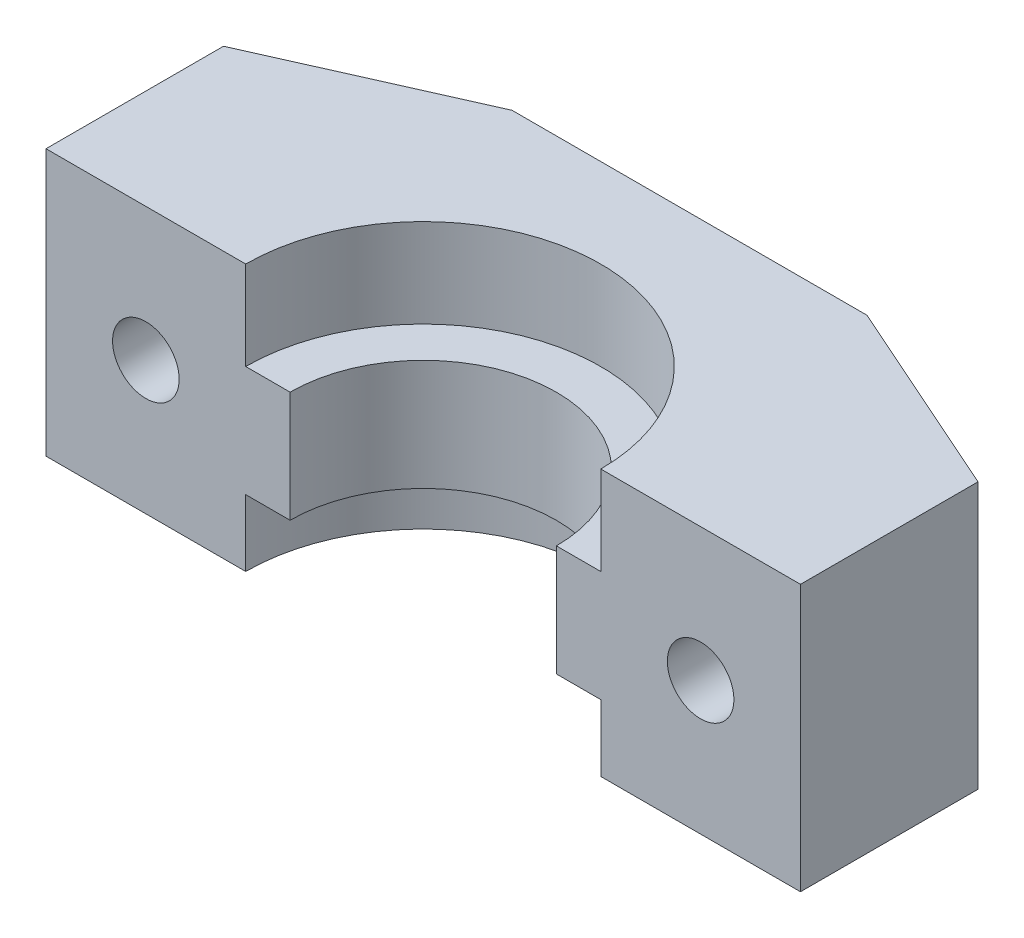
from build123d import *

# Parameters (mm, degrees)
EXTRUDE_1_DEPTH          = 12
SKETCH_3_R               = 1.5
CUT_EXTRUDE_1_DEPTH      = 39
CUT_EXTRUDE_START        = -6
SKETCH_4_R               = 3.5
CUT_EXTRUDE_2_DEPTH      = 33
SKETCH_5_R               = 3.5
CUT_EXTRUDE_4_DEPTH      = 33
CUT_EXTRUDE_6_DEPTH      = 39
CUT_EXTRUDE_6_DEPTH_BACK = 4
CUT_EXTRUDE_7_DEPTH      = 39
CUT_EXTRUDE_7_DEPTH_BACK = 3


with BuildPart() as part:
    # Эскиз2 → Бобышка-Вытянуть1 (new body)
    with BuildSketch(Plane(origin=(0, 0, 0), x_dir=(1, 0, 0), z_dir=(0, 1, 0))):
        with BuildLine():
            Line((0, 0), (0, 8))
            Line((0, 8), (9, 12))
            Line((9, 12), (25, 12))
            Line((25, 12), (34, 8))
            Line((34, 8), (34, 0))
            Line((34, 0), (23, 0))
            ThreePointArc((23, 0), (17, 6), (11, 0))
            Line((11, 0), (0, 0))
        make_face()
    extrude(amount=EXTRUDE_1_DEPTH)

    # Эскиз3 → Вырез-Вытянуть1 (cut, through all)
    with BuildSketch(Plane.XY):
        with Locations((4.5, 6)):
            Circle(SKETCH_3_R)
        with Locations((29.5, 6)):
            Circle(SKETCH_3_R)
    extrude(amount=-CUT_EXTRUDE_1_DEPTH, mode=Mode.SUBTRACT)

    # Эскиз4 → Вырез-Вытянуть2 (cut, through all)
    with BuildSketch(Plane.XY.offset(CUT_EXTRUDE_START)):
        with Locations((4.5, 6)):
            Circle(SKETCH_4_R)
    extrude(amount=-CUT_EXTRUDE_2_DEPTH, mode=Mode.SUBTRACT)

    # Эскиз5 → Вырез-Вытянуть4 (cut, through all)
    with BuildSketch(Plane.XY.offset(CUT_EXTRUDE_START)):
        with Locations((29.5, 6)):
            Circle(SKETCH_5_R)
    extrude(amount=-CUT_EXTRUDE_4_DEPTH, mode=Mode.SUBTRACT)

    # Эскиз6 → Вырез-Вытянуть6 (cut, two sides: drawn at the far end of the back side and taken through both)
    with BuildSketch(Plane(origin=(0, 12, 0), x_dir=(1, 0, 0), z_dir=(0, 1, 0)).offset(-CUT_EXTRUDE_6_DEPTH_BACK)):
        with BuildLine():
            Line((9, -65.461698495), (9, 0))
            ThreePointArc((9, 0), (17, 8), (25, 0))
            Line((25, 0), (25, -65.461698495))
            Line((25, -65.461698495), (25, -196.385095486))
            Line((25, -196.385095486), (9, -196.385095486))
            Line((9, -196.385095486), (9, -65.461698495))
        make_face()
    extrude(amount=CUT_EXTRUDE_6_DEPTH + CUT_EXTRUDE_6_DEPTH_BACK, mode=Mode.SUBTRACT)

    # Эскиз7 → Вырез-Вытянуть7 (cut, two sides: drawn at the far end of the back side and taken through both)
    with BuildSketch(Plane(origin=(0, 0, 0), x_dir=(-1, 0, 0), z_dir=(0, -1, 0)).offset(-CUT_EXTRUDE_7_DEPTH_BACK)):
        with BuildLine():
            Line((-9, -65.461698495), (-9, 0))
            ThreePointArc((-9, 0), (-17, 8), (-25, 0))
            Line((-25, 0), (-25, -65.461698495))
            Line((-25, -65.461698495), (-25, -196.385095486))
            Line((-25, -196.385095486), (-9, -196.385095486))
            Line((-9, -196.385095486), (-9, -65.461698495))
        make_face()
    extrude(amount=CUT_EXTRUDE_7_DEPTH + CUT_EXTRUDE_7_DEPTH_BACK, mode=Mode.SUBTRACT)


solid = part.part
